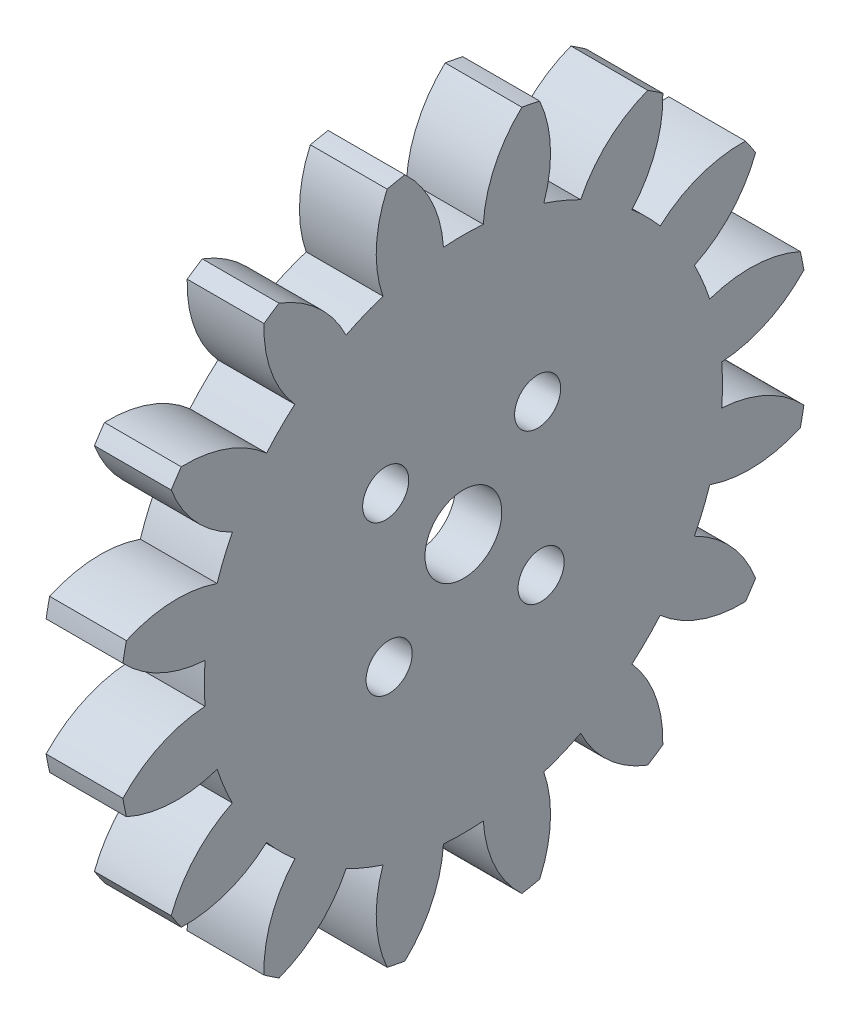
from build123d import *

# Parameters (mm, degrees)
BASPROSKE_W             = 5
BASPROSKE_H             = 22.5
TOOTHCUT_DEPTH          = 33.210246817
TEETHCUTS_COUNT         = 16
TEETHCUTS_ANGLE         = 337.5
BORSKE_R                = 2.5
BORE_DEPTH              = 50.0000508
ENL_V_START             = -3
ESQUISSE3_R             = 10
ENL_V_MAT_EXTRU_3_DEPTH = 29.756555396
ESQUISSE8_R             = 1.5
ENL_V_MAT_EXTRU_4_DEPTH = 32.756555396


with BuildPart() as part:
    # BasProSke → Base-Revolve (revolve)
    with BuildSketch(Plane(origin=(0, 0, 0), x_dir=(1, 0, 0), z_dir=(0, 1, 0)), mode=Mode.PRIVATE) as base_revolve_sk:
        with Locations((2.5, 11.25)):
            Rectangle(BASPROSKE_W, BASPROSKE_H)
    revolve(base_revolve_sk.sketch.rotate(Axis((-10, 0, 0), (1, 0, 0)), 180), axis=Axis((-10, 0, 0), (1, 0, 0)))

    # TooCutSke → ToothCut (cut, through all)
    with BuildSketch(Plane(origin=(0, 0, 0), x_dir=(0, 0, -1), z_dir=(1, 0, 0))):
        with BuildLine():
            ThreePointArc((1.297749273, 16.824022195), (0, 16.874), (-1.297749273, 16.824022195))
            ThreePointArc((-1.297749273, 16.824022195), (-2.047921493, 19.754510488), (-3.832565589, 22.196961192))
            ThreePointArc((-3.832565589, 22.196961192), (0, 22.5254), (3.832565589, 22.196961192))
            ThreePointArc((3.832565589, 22.196961192), (2.047921493, 19.754510488), (1.297749273, 16.824022195))
        make_face()
    toothcut = extrude(amount=TOOTHCUT_DEPTH, mode=Mode.SUBTRACT)

    # TeethCuts: ToothCut ×16 about axis
    teethcuts_axis = Axis((-10, 0, 0), (1, 0, 0))
    for i in range(1, TEETHCUTS_COUNT):
        add(toothcut.rotate(teethcuts_axis, i * TEETHCUTS_ANGLE / (TEETHCUTS_COUNT - 1)), mode=Mode.SUBTRACT)

    # BorSke → Bore (cut, symmetric)
    with BuildSketch(Plane(origin=(0, 0, 0), x_dir=(0, 0, -1), z_dir=(1, 0, 0))):
        with Locations(Location((0, 0, 0), (0, 0, 180))):
            Circle(BORSKE_R)
    extrude(amount=BORE_DEPTH, both=True, mode=Mode.SUBTRACT)

    # Esquisse3 → Enlèv. mat.-Extru.3 (cut, through all)
    with BuildSketch(Plane(origin=(5, 0, 0), x_dir=(0, 0, -1), z_dir=(1, 0, 0)).offset(ENL_V_START)):
        Circle(ESQUISSE3_R)
    extrude(amount=-ENL_V_MAT_EXTRU_3_DEPTH, mode=Mode.SUBTRACT)

    # Esquisse8 → Enlèv. mat.-Extru.4 (cut, through all)
    with BuildSketch(Plane.ZY):
        with Locations((5.060877471, 4.836064435)):
            Circle(ESQUISSE8_R)
        with Locations((-4.836064435, 5.060877471)):
            Circle(ESQUISSE8_R)
        with Locations((4.836064435, -5.060877471)):
            Circle(ESQUISSE8_R)
        with Locations((-5.060877471, -4.836064435)):
            Circle(ESQUISSE8_R)
    extrude(amount=-ENL_V_MAT_EXTRU_4_DEPTH, mode=Mode.SUBTRACT)


solid = part.part
